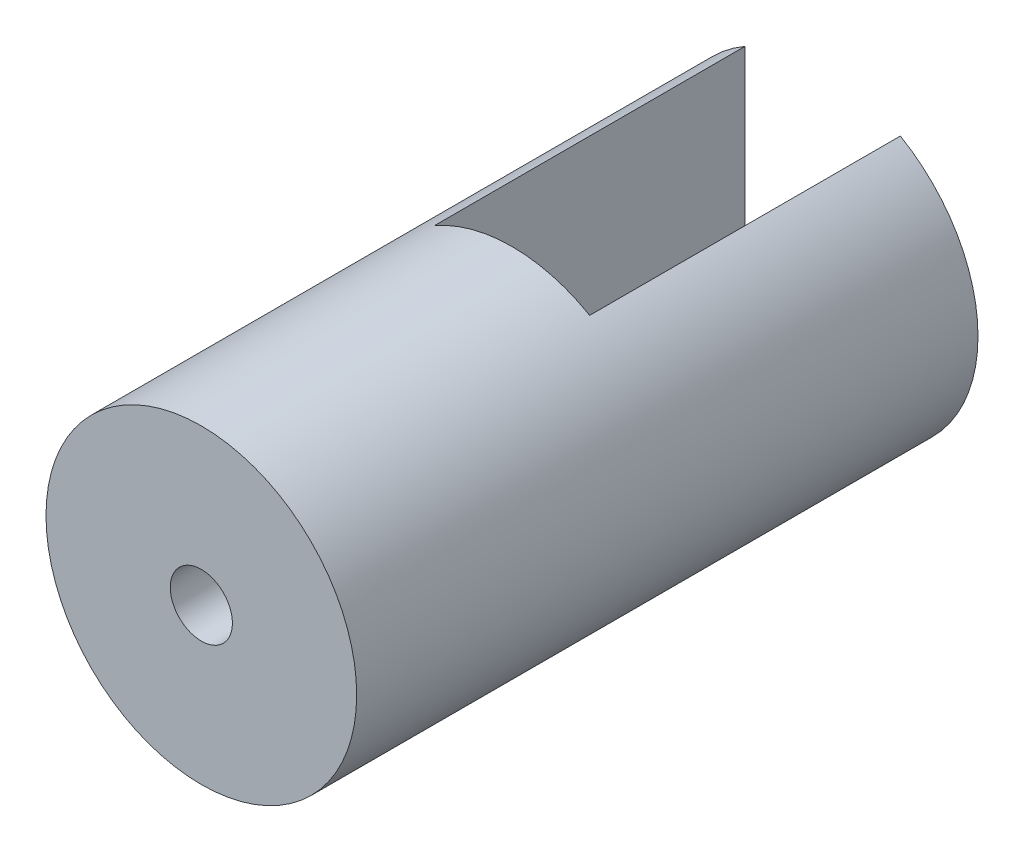
from build123d import *

# Parameters (mm, degrees)
CROQUIS1_R              = 5
SALIENTE_EXTRUIR1_DEPTH = 20
CROQUIS3_W              = 5
CROQUIS3_H              = 10
CORTAR_EXTRUIR1_DEPTH   = 10
CROQUIS4_R              = 1
CORTAR_EXTRUIR2_DEPTH   = 10


with BuildPart() as part:
    # Croquis1 → Saliente-Extruir1 (new body)
    with BuildSketch(Plane.XY):
        Circle(CROQUIS1_R)
    extrude(amount=SALIENTE_EXTRUIR1_DEPTH)

    # Croquis3 → Cortar-Extruir1 (cut)
    with BuildSketch(Plane(origin=(0, 0, 0), x_dir=(-1, 0, 0), z_dir=(0, 0, -1))):
        Rectangle(CROQUIS3_W, CROQUIS3_H)
    extrude(amount=-CORTAR_EXTRUIR1_DEPTH, mode=Mode.SUBTRACT)

    # Croquis4 → Cortar-Extruir2 (cut)
    with BuildSketch(Plane(origin=(2.5, -4.330127019, 10), x_dir=(-1, 0, 0), z_dir=(0, 0, -1))):
        with Locations((2.5, 4.330127019)):
            Circle(CROQUIS4_R)
    extrude(amount=-CORTAR_EXTRUIR2_DEPTH, mode=Mode.SUBTRACT)


solid = part.part
